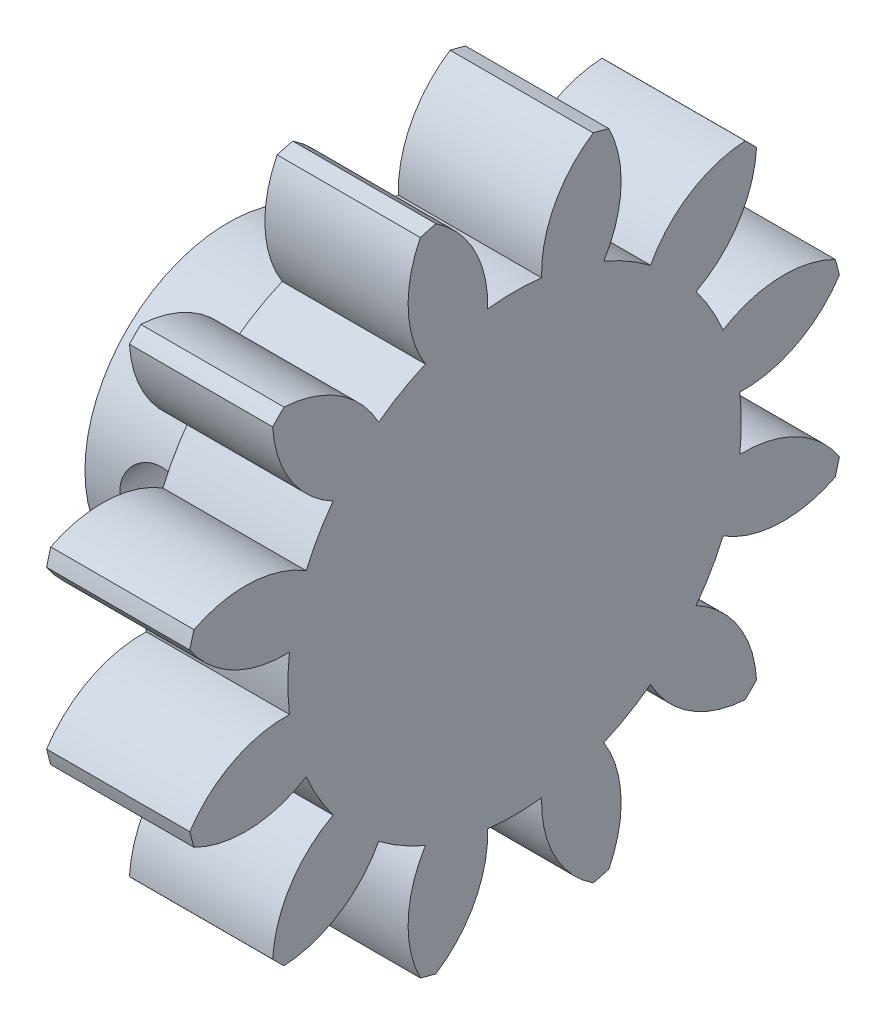
from build123d import *

# Parameters (mm, degrees)
BASPROSKE_W             = 12.7
BASPROSKE_H             = 29.633333333
TOOTHCUT_DEPTH          = 44.789940499
TEETHCUTS_COUNT         = 12
TEETHCUTS_ANGLE         = 330
SKETCH1_R               = 12.7
SKETCH1_R_2             = 5.715
BOSS_EXTRUDE1_DEPTH     = 12.7
CUT_EXTRUDE1_REACH      = 55.104
CUT_EXTRUDE1_END_RADIUS = 5.715
SKETCH2_R               = 3.2512
CUT_EXTRUDE2_DEPTH      = 7.62


with BuildPart() as part:
    # BasProSke → Base-Revolve (revolve)
    with BuildSketch(Plane(origin=(0, 0, 0), x_dir=(1, 0, 0), z_dir=(0, 1, 0)), mode=Mode.PRIVATE) as base_revolve_sk:
        with Locations((6.35, 14.816666667)):
            Rectangle(BASPROSKE_W, BASPROSKE_H)
    revolve(base_revolve_sk.sketch.rotate(Axis((-10, 0, 0), (1, 0, 0)), 180), axis=Axis((-10, 0, 0), (1, 0, 0)))

    # TooCutSke → ToothCut (cut, through all)
    with BuildSketch(Plane(origin=(0, 0, 0), x_dir=(0, 0, -1), z_dir=(1, 0, 0))):
        with BuildLine():
            ThreePointArc((2.3928109, 19.964179219), (0, 20.107063333), (-2.3928109, 19.964179219))
            ThreePointArc((-2.3928109, 19.964179219), (-3.536123556, 24.99754811), (-7.005125344, 28.819588509))
            ThreePointArc((-7.005125344, 28.819588509), (0, 29.658733333), (7.005125344, 28.819588509))
            ThreePointArc((7.005125344, 28.819588509), (3.536123556, 24.99754811), (2.3928109, 19.964179219))
        make_face()
    toothcut = extrude(amount=TOOTHCUT_DEPTH, mode=Mode.SUBTRACT)

    # TeethCuts: ToothCut ×12 about axis
    teethcuts_axis = Axis((-10, 0, 0), (1, 0, 0))
    for i in range(1, TEETHCUTS_COUNT):
        add(toothcut.rotate(teethcuts_axis, i * TEETHCUTS_ANGLE / (TEETHCUTS_COUNT - 1)), mode=Mode.SUBTRACT)

    # Sketch1 → Boss-Extrude1 (add)
    with BuildSketch(Plane.ZY):
        with Locations(Location((0, 0, 0), (0, 0, 180))):
            Circle(SKETCH1_R)
        Circle(SKETCH1_R_2, mode=Mode.SUBTRACT)
    extrude(amount=BOSS_EXTRUDE1_DEPTH)

    # Cut-Extrude1: up to this cylinder (the profile starts outside it)
    cut_extrude1_end = Plane(origin=(-6.35, 0, 0), z_dir=(1, 0, 0)) * Cylinder(CUT_EXTRUDE1_END_RADIUS, 122.638, mode=Mode.PRIVATE)
    # Sketch2 → Cut-Extrude1 (cut, up to the surface)
    with BuildSketch(Plane.XY.offset(13.97), mode=Mode.PRIVATE) as cut_extrude1_sk1:
        with Locations((-6.35, 0)):
            Circle(SKETCH2_R)
    cut_extrude1_tool1 = extrude(cut_extrude1_sk1.sketch, amount=-CUT_EXTRUDE1_REACH, mode=Mode.PRIVATE) - cut_extrude1_end
    add(cut_extrude1_tool1.solids().sort_by_distance((-6.35, 0, 13.97))[0], mode=Mode.SUBTRACT)

    # Sketch4 → Cut-Extrude2 (cut)
    with BuildSketch(Plane.XY):
        Polygon((-1.524, 2.786292399), (-6.35, 5.572584798), (-11.176, 2.786292399), (-11.176, -2.786292399), (-6.35, -5.572584798), (-1.524, -2.786292399), align=None)
    extrude(amount=CUT_EXTRUDE2_DEPTH, mode=Mode.SUBTRACT)


solid = part.part
